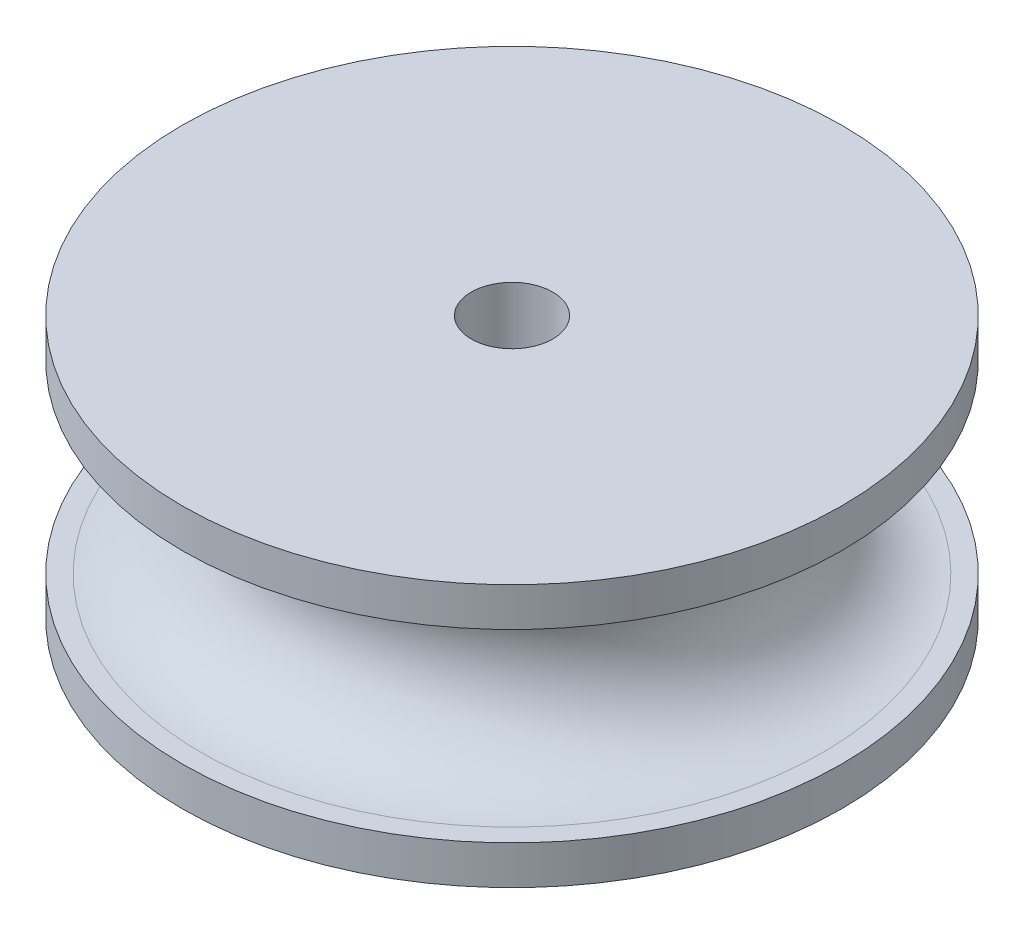
from build123d import *


with BuildPart() as part:
    # Sketch1 → Revolve1 (revolve)
    with BuildSketch(Plane.XY, mode=Mode.PRIVATE) as revolve1_sk:
        with BuildLine():
            Line((-1.05, 0), (-1.05, 6.7625))
            Line((-1.05, 6.7625), (-8.5, 6.7625))
            Line((-8.5, 6.7625), (-8.5, 5.7625))
            Line((-8.5, 5.7625), (-8, 5.7625))
            ThreePointArc((-8, 5.7625), (-5.61875, 3.38125), (-8, 1))
            Line((-8, 1), (-8.5, 1))
            Line((-8.5, 1), (-8.5, 0))
            Line((-8.5, 0), (-1.05, 0))
        make_face()
    revolve(revolve1_sk.sketch.rotate(Axis((0, 0, 0), (0, 1, 0)), 270), axis=Axis((0, 0, 0), (0, 1, 0)))


solid = part.part
